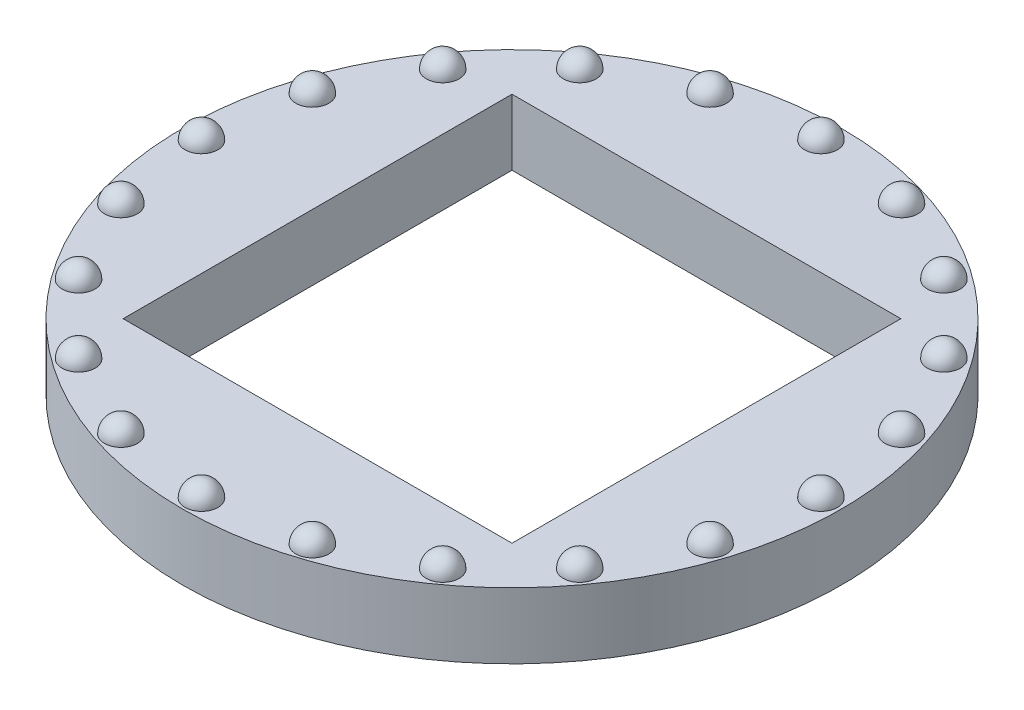
from build123d import *

# Parameters (mm, degrees)
SKETCH1_R           = 40
BOSS_EXTRUDE1_DEPTH = 8
CIRPATTERN1_COUNT   = 20
SKETCH4_W           = 47.2
SKETCH4_H           = 47.2
CUT_EXTRUDE1_DEPTH  = 10


with BuildPart() as part:
    # Sketch1 → Boss-Extrude1 (new body)
    with BuildSketch(Plane(origin=(0, 0, 0), x_dir=(1, 0, 0), z_dir=(0, 1, 0))):
        with Locations(Location((0, 0, 0), (0, 0, 270))):
            Circle(SKETCH1_R)
    extrude(amount=BOSS_EXTRUDE1_DEPTH)

    # Sketch3 → Revolve1 (revolve)
    with BuildSketch(Plane(origin=(0, 0, 0), x_dir=(0, 0, -1), z_dir=(1, 0, 0))):
        with BuildLine():
            Line((37.5, 8), (37.5, 10))
            ThreePointArc((37.5, 10), (38.914213562, 9.414213562), (39.5, 8))
            Line((39.5, 8), (37.5, 8))
        make_face()
    revolve1 = revolve(axis=Axis((0, 8, -37.5), (0, 1, 0)))

    # CirPattern1: Revolve1 ×20 about axis
    cirpattern1_axis = Axis((0, 0, 0.093984962), (0, 1, 0))
    for i in range(1, CIRPATTERN1_COUNT):
        add(revolve1.rotate(cirpattern1_axis, i * 360 / CIRPATTERN1_COUNT))

    # Sketch4 → Cut-Extrude1 (cut)
    with BuildSketch(Plane.XZ):
        Rectangle(SKETCH4_W, SKETCH4_H)
    extrude(amount=-CUT_EXTRUDE1_DEPTH, mode=Mode.SUBTRACT)


solid = part.part
